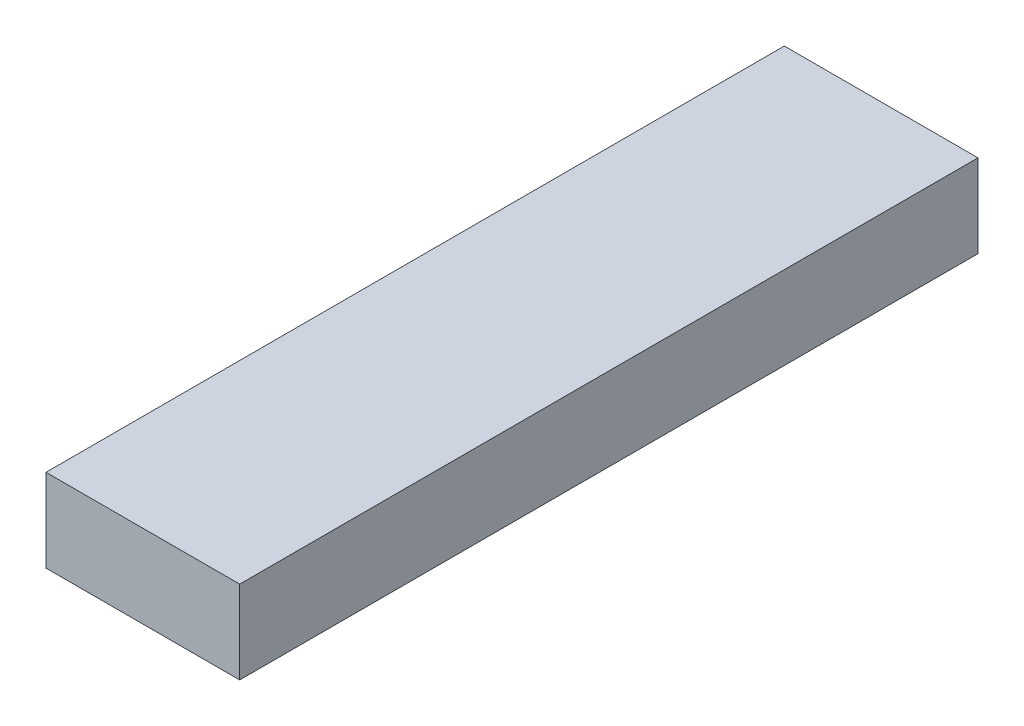
from build123d import *

# Parameters (mm, degrees)
SKETCH1_W           = 88.9
SKETCH1_H           = 38.1
BOSS_EXTRUDE1_DEPTH = 338.900008


with BuildPart() as part:
    # Sketch1 → Boss-Extrude1 (new body)
    with BuildSketch(Plane.XY):
        Rectangle(SKETCH1_W, SKETCH1_H)
    extrude(amount=BOSS_EXTRUDE1_DEPTH)


solid = part.part
